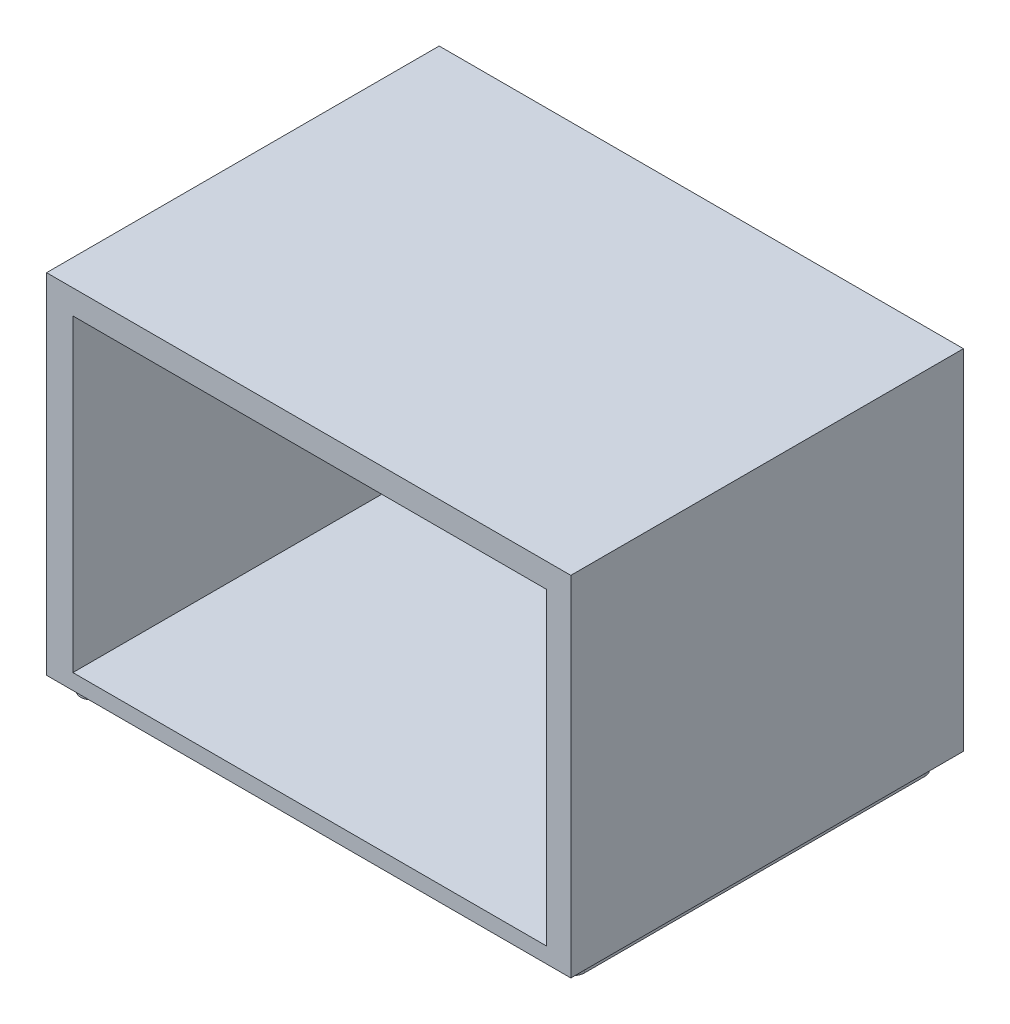
from build123d import *

# Parameters (mm, degrees)
IZIM1_W                     = 112.077867903
IZIM1_H                     = 74.551796061
Y_KSEKLIK_EKSTR_ZYON1_DEPTH = 83.934945503
IZIM2_W                     = 101.231343604
IZIM2_H                     = 66.034767048
KES_EKSTR_ZYON2_DEPTH       = 76.644430763
IZIM3_W                     = 39.444954406
IZIM3_H                     = 29.43714267
KES_EKSTR_ZYON3_DEPTH       = 88.138
Y_KSEKLIK_EKSTR_ZYON2_DEPTH = 2.54


with BuildPart() as part:
    # Çizim1 → Yükseklik-Ekstrüzyon1 (new body)
    with BuildSketch(Plane.XY):
        with Locations((-65.092964498, -0.375260719)):
            Rectangle(IZIM1_W, IZIM1_H)
    extrude(amount=Y_KSEKLIK_EKSTR_ZYON1_DEPTH)

    # Çizim2 → Kes-Ekstrüzyon2 (cut)
    with BuildSketch(Plane.XY.offset(83.934945503)):
        with Locations((-64.892181627, -1.311030391)):
            Rectangle(IZIM2_W, IZIM2_H)
    extrude(amount=-KES_EKSTR_ZYON2_DEPTH, mode=Mode.SUBTRACT)

    # Çizim3 → Kes-Ekstrüzyon3 (cut)
    with BuildSketch(Plane.XY.offset(7.29051474)):
        with Locations((-56.533774773, 7.010455604)):
            Rectangle(IZIM3_W, IZIM3_H)
    extrude(amount=-KES_EKSTR_ZYON3_DEPTH, mode=Mode.SUBTRACT)

    # Çizim4 → Yükseklik-Ekstrüzyon2 (add)
    with BuildSketch(Plane(origin=(0, -37.651158749, 0), x_dir=(-1, 0, 0), z_dir=(0, -1, 0))):
        with BuildLine():
            Line((113.611032553, -79.46460314), (113.611032553, -6.689235104))
            ThreePointArc((113.611032553, -6.689235104), (115.960654564, -4.339613094), (118.310276574, -6.689235104))
            Line((118.310276574, -6.689235104), (118.310276574, -79.46460314))
            ThreePointArc((118.310276574, -79.46460314), (115.960654564, -81.814225151), (113.611032553, -79.46460314))
        make_face()
        with BuildLine():
            Line((11.064518037, -78.985150192), (11.064518037, -6.209782156))
            ThreePointArc((11.064518037, -6.209782156), (13.414140048, -3.860160145), (15.763762058, -6.209782156))
            Line((15.763762058, -6.209782156), (15.763762058, -78.985150192))
            ThreePointArc((15.763762058, -78.985150192), (13.414140048, -81.334772203), (11.064518037, -78.985150192))
        make_face()
    extrude(amount=Y_KSEKLIK_EKSTR_ZYON2_DEPTH)


solid = part.part
